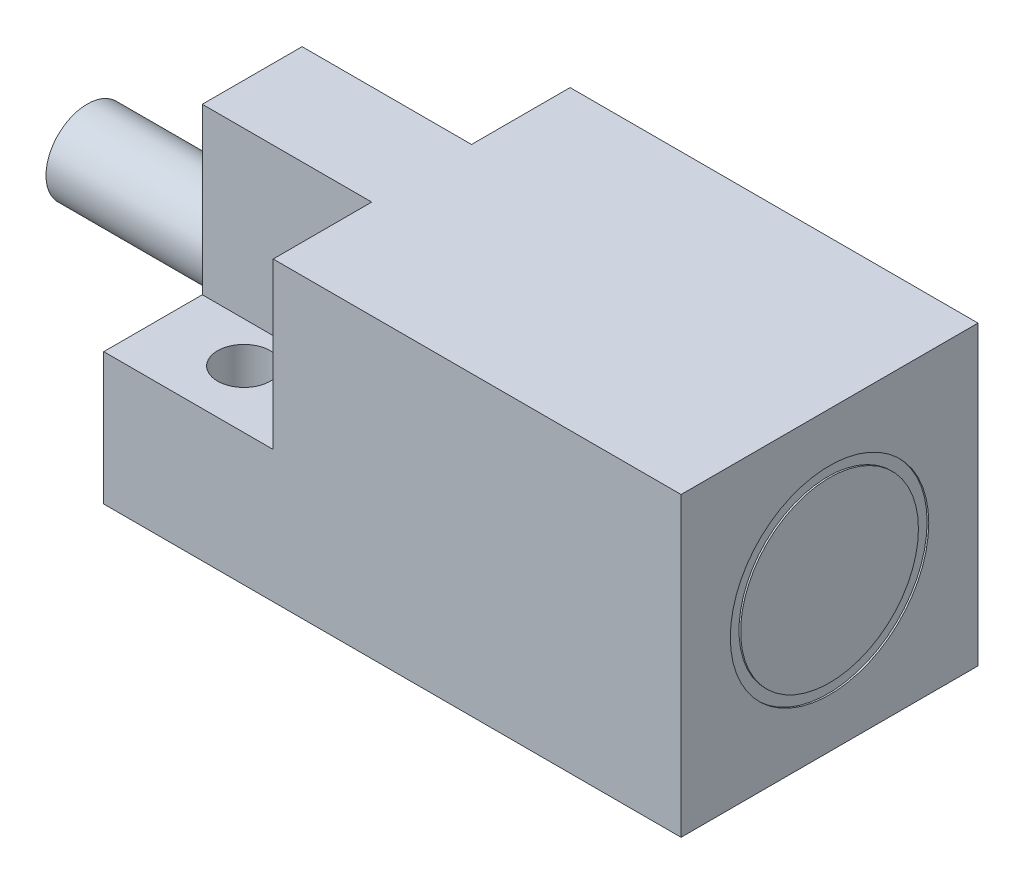
from build123d import *

# Parameters (mm, degrees)
SKETCH_1_W          = 35
SKETCH_1_H          = 18
EXTRUDE_1_DEPTH     = 9
SKETCH_2_R          = 6.015690921
SKETCH_2_R_2        = 5.389890323
CUT_EXTRUDE_1_DEPTH = 0.1
SKETCH_3_R          = 1.6
CUT_EXTRUDE_2_DEPTH = 27.669270706
SKETCH_4_R          = 2.5
EXTRUDE_2_DEPTH     = 10
SKETCH_5_W          = 10.271095748
SKETCH_5_H          = 5.975058515
CUT_EXTRUDE_3_DEPTH = 10


with BuildPart() as part:
    # 草图1 → 凸台-拉伸1 (new, symmetric)
    with BuildSketch(Plane(origin=(0, 0, 0), x_dir=(1, 0, 0), z_dir=(0, 1, 0))):
        Rectangle(SKETCH_1_W, SKETCH_1_H)
    extrude(amount=EXTRUDE_1_DEPTH, both=True)

    # 草图2 → 切除-拉伸1 (cut)
    with BuildSketch(Plane(origin=(17.5, 0, 0), x_dir=(0, 0, -1), z_dir=(1, 0, 0))):
        Circle(SKETCH_2_R)
        Circle(SKETCH_2_R_2, mode=Mode.SUBTRACT)
    extrude(amount=-CUT_EXTRUDE_1_DEPTH, mode=Mode.SUBTRACT)

    # 草图3 → 切除-拉伸2 (cut, through all)
    with BuildSketch(Plane(origin=(0, 9, 0), x_dir=(1, 0, 0), z_dir=(0, 1, 0))):
        with Locations(Location((-12.5, 5.5, 0), (0, 0, 270))):
            Circle(SKETCH_3_R)
        with Locations(Location((-12.5, -5.5, 0), (0, 0, 270))):
            Circle(SKETCH_3_R)
    extrude(amount=-CUT_EXTRUDE_2_DEPTH, mode=Mode.SUBTRACT)

    # 草图4 → 凸台-拉伸2 (add)
    with BuildSketch(Plane.ZY.offset(17.5)):
        with Locations(Location((0, 0, 0), (0, 0, 180))):
            Circle(SKETCH_4_R)
    extrude(amount=EXTRUDE_2_DEPTH)

    # 草图5 → 切除-拉伸3 (cut)
    with BuildSketch(Plane(origin=(0, 9, 0), x_dir=(1, 0, 0), z_dir=(0, 1, 0))):
        with Locations((-12.364452126, 6.012470742)):
            Rectangle(SKETCH_5_W, SKETCH_5_H)
        with Locations((-12.364452126, -6.012470742)):
            Rectangle(SKETCH_5_W, SKETCH_5_H)
    extrude(amount=-CUT_EXTRUDE_3_DEPTH, mode=Mode.SUBTRACT)


solid = part.part
